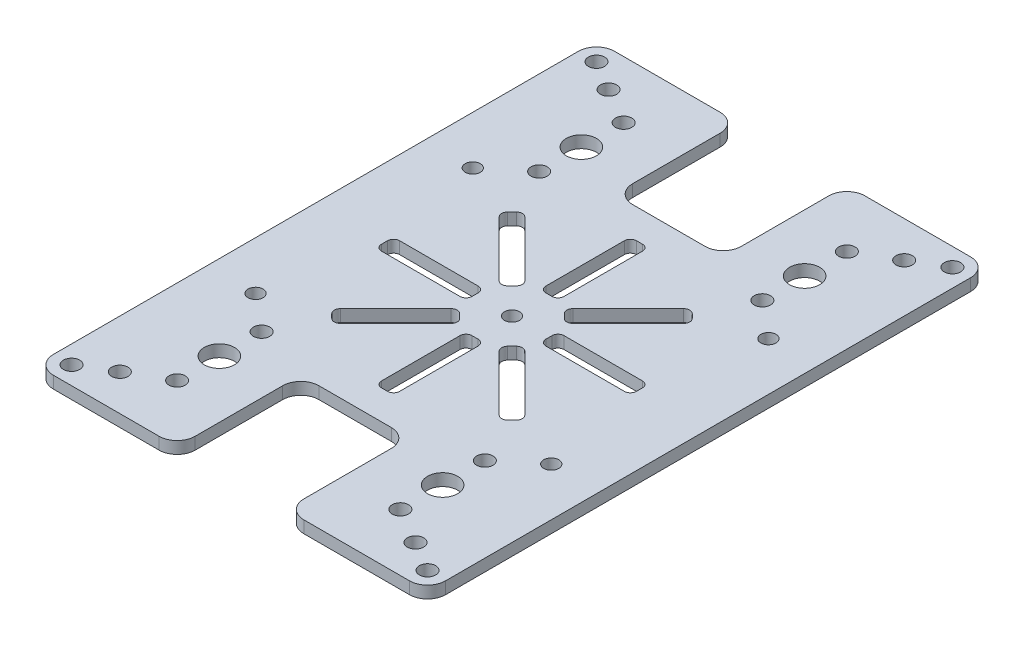
from build123d import *

# Parameters (mm, degrees)
BOSS_EXTRUDE1_DEPTH                          = 2
FILLET1_R                                    = 3
CUT_EXTRUDE1_REACH                           = 58.767
SKETCH2_R                                    = 1.25
CIRPATTERN1_COUNT                            = 8
CUT_EXTRUDE2_REACH                           = 58.767
SKETCH3_R                                    = 1.35
SKETCH3_R_2                                  = 1.25
SKETCH3_R_3                                  = 2.5
MIRROR1_AT_THE_SECOND_PLANE_COPY_1_REACH     = 58.767
MIRROR1_AT_THE_SECOND_PLANE_COPY_1_SKETC_R   = 1.35
MIRROR1_AT_THE_SECOND_PLANE_COPY_1_SKETC_R_2 = 1.25
MIRROR1_AT_THE_SECOND_PLANE_COPY_1_SKETC_R_3 = 2.5


with BuildPart() as part:
    # Sketch1 → Boss-Extrude1 (new body)
    with BuildSketch(Plane(origin=(0, 0, 0), x_dir=(1, 0, 0), z_dir=(0, 1, 0))):
        Polygon((9, 26), (-9, 26), (-9, 46.5), (-32.5, 46.5), (-32.5, -46.5), (-9, -46.5), (-9, -26), (9, -26), (9, -46.5), (32.5, -46.5), (32.5, 46.5), (9, 46.5), align=None)
    extrude(amount=BOSS_EXTRUDE1_DEPTH)

    # Fillet1
    fillet1_edges = [part.edges().sort_by_distance(p)[0] for p in [
        (-9, 1, -26),
        (9, 1, -26),
        (9, 1, -46.5),
        (32.5, 1, -46.5),
        (32.5, 1, 46.5),
        (9, 1, 46.5),
        (9, 1, 26),
        (-9, 1, 26),
        (-9, 1, 46.5),
        (-32.5, 1, 46.5),
        (-32.5, 1, -46.5),
        (-9, 1, -46.5),
    ]]
    fillet(fillet1_edges, radius=FILLET1_R)

    # Sketch2 → Cut-Extrude1 (cut, up to next)
    with BuildSketch(Plane(origin=(0, 2, 0), x_dir=(1, 0, 0), z_dir=(0, 1, 0)), mode=Mode.PRIVATE) as cut_extrude1_sk1:
        with Locations(Location((0, 0, 0), (0, 0, 270))):
            Circle(SKETCH2_R)
    cut_extrude1_tool1 = extrude(cut_extrude1_sk1.sketch, amount=-CUT_EXTRUDE1_REACH, mode=Mode.PRIVATE) & part.part
    # Sketch2 → Cut-Extrude1 (cut, up to next)
    with BuildSketch(Plane(origin=(0, 2, 0), x_dir=(1, 0, 0), z_dir=(0, 1, 0)), mode=Mode.PRIVATE) as cut_extrude1_sk2:
        with BuildLine():
            Line((0.5, 21.125), (-0.5, 21.125))
            ThreePointArc((-0.5, 21.125), (-1.207106781, 20.832106781), (-1.5, 20.125))
            Line((-1.5, 20.125), (-1.5, 7.125))
            ThreePointArc((-1.5, 7.125), (-1.207106781, 6.417893219), (-0.5, 6.125))
            Line((-0.5, 6.125), (0.5, 6.125))
            ThreePointArc((0.5, 6.125), (1.207106781, 6.417893219), (1.5, 7.125))
            Line((1.5, 7.125), (1.5, 20.125))
            ThreePointArc((1.5, 20.125), (1.207106781, 20.832106781), (0.5, 21.125))
        make_face()
    cut_extrude1_tool2 = extrude(cut_extrude1_sk2.sketch, amount=-CUT_EXTRUDE1_REACH, mode=Mode.PRIVATE) & part.part
    cut_extrude1_1 = cut_extrude1_tool1.solids().sort_by_distance((0, 2, 0))[0]
    add(cut_extrude1_1, mode=Mode.SUBTRACT)
    cut_extrude1_2 = cut_extrude1_tool2.solids().sort_by_distance((0, 2, -13.625))[0]
    add(cut_extrude1_2, mode=Mode.SUBTRACT)
    cut_extrude1 = cut_extrude1_1 + cut_extrude1_2  # Cut-Extrude1 as one shape, for the pattern or mirror that repeats it

    # CirPattern1: Cut-Extrude1 ×8 about axis
    cirpattern1_axis = Axis((0, 0, 0), (0, 1, 0))
    for i in range(1, CIRPATTERN1_COUNT):
        add(cut_extrude1.rotate(cirpattern1_axis, i * 360 / CIRPATTERN1_COUNT), mode=Mode.SUBTRACT)

    # Sketch3 → Cut-Extrude2 (cut, up to next)
    with BuildSketch(Plane(origin=(0, 2, 0), x_dir=(1, 0, 0), z_dir=(0, 1, 0)), mode=Mode.PRIVATE) as cut_extrude2_sk1:
        with Locations(Location((-29.5, 43.5, 0), (0, 0, 270))):
            Circle(SKETCH3_R)
    cut_extrude2_tool1 = extrude(cut_extrude2_sk1.sketch, amount=-CUT_EXTRUDE2_REACH, mode=Mode.PRIVATE) & part.part
    # Sketch3 → Cut-Extrude2 (cut, up to next)
    with BuildSketch(Plane(origin=(0, 2, 0), x_dir=(1, 0, 0), z_dir=(0, 1, 0)), mode=Mode.PRIVATE) as cut_extrude2_sk2:
        with Locations(Location((-24.5, 40.5, 0), (0, 0, 270))):
            Circle(SKETCH3_R)
    cut_extrude2_tool2 = extrude(cut_extrude2_sk2.sketch, amount=-CUT_EXTRUDE2_REACH, mode=Mode.PRIVATE) & part.part
    # Sketch3 → Cut-Extrude2 (cut, up to next)
    with BuildSketch(Plane(origin=(0, 2, 0), x_dir=(1, 0, 0), z_dir=(0, 1, 0)), mode=Mode.PRIVATE) as cut_extrude2_sk3:
        with Locations(Location((-24.5, 18, 0), (0, 0, 270))):
            Circle(SKETCH3_R_2)
    cut_extrude2_tool3 = extrude(cut_extrude2_sk3.sketch, amount=-CUT_EXTRUDE2_REACH, mode=Mode.PRIVATE) & part.part
    # Sketch3 → Cut-Extrude2 (cut, up to next)
    with BuildSketch(Plane(origin=(0, 2, 0), x_dir=(1, 0, 0), z_dir=(0, 1, 0)), mode=Mode.PRIVATE) as cut_extrude2_sk4:
        with Locations(Location((-18.5, 37, 0), (0, 0, 270))):
            Circle(SKETCH3_R)
    cut_extrude2_tool4 = extrude(cut_extrude2_sk4.sketch, amount=-CUT_EXTRUDE2_REACH, mode=Mode.PRIVATE) & part.part
    # Sketch3 → Cut-Extrude2 (cut, up to next)
    with BuildSketch(Plane(origin=(0, 2, 0), x_dir=(1, 0, 0), z_dir=(0, 1, 0)), mode=Mode.PRIVATE) as cut_extrude2_sk5:
        with Locations(Location((-18.5, 23, 0), (0, 0, 270))):
            Circle(SKETCH3_R)
    cut_extrude2_tool5 = extrude(cut_extrude2_sk5.sketch, amount=-CUT_EXTRUDE2_REACH, mode=Mode.PRIVATE) & part.part
    # Sketch3 → Cut-Extrude2 (cut, up to next)
    with BuildSketch(Plane(origin=(0, 2, 0), x_dir=(1, 0, 0), z_dir=(0, 1, 0)), mode=Mode.PRIVATE) as cut_extrude2_sk6:
        with Locations(Location((-18.5, 30, 0), (0, 0, 270))):
            Circle(SKETCH3_R_3)
    cut_extrude2_tool6 = extrude(cut_extrude2_sk6.sketch, amount=-CUT_EXTRUDE2_REACH, mode=Mode.PRIVATE) & part.part
    cut_extrude2_1 = cut_extrude2_tool1.solids().sort_by_distance((-29.5, 2, -43.5))[0]
    add(cut_extrude2_1, mode=Mode.SUBTRACT)
    cut_extrude2_2 = cut_extrude2_tool2.solids().sort_by_distance((-24.5, 2, -40.5))[0]
    add(cut_extrude2_2, mode=Mode.SUBTRACT)
    cut_extrude2_3 = cut_extrude2_tool3.solids().sort_by_distance((-24.5, 2, -18))[0]
    add(cut_extrude2_3, mode=Mode.SUBTRACT)
    cut_extrude2_4 = cut_extrude2_tool4.solids().sort_by_distance((-18.5, 2, -37))[0]
    add(cut_extrude2_4, mode=Mode.SUBTRACT)
    cut_extrude2_5 = cut_extrude2_tool5.solids().sort_by_distance((-18.5, 2, -23))[0]
    add(cut_extrude2_5, mode=Mode.SUBTRACT)
    cut_extrude2_6 = cut_extrude2_tool6.solids().sort_by_distance((-18.5, 2, -30))[0]
    add(cut_extrude2_6, mode=Mode.SUBTRACT)
    cut_extrude2 = cut_extrude2_1 + cut_extrude2_2 + cut_extrude2_3 + cut_extrude2_4 + cut_extrude2_5 + cut_extrude2_6  # Cut-Extrude2 as one shape, for the pattern or mirror that repeats it

    # Mirror1: Cut-Extrude2 across plane
    add(cut_extrude2.mirror(Plane(origin=(0, 0, 0), x_dir=(0, 0, 1), z_dir=(1, 0, 0))), mode=Mode.SUBTRACT)

    # Mirror1 at the second plane: Cut-Extrude2 across plane
    add(cut_extrude2.mirror(Plane.XY), mode=Mode.SUBTRACT)

    # Mirror1 at the second plane copy 1 sketc → Mirror1 at the second plane copy 1 (cut, up to next)
    with BuildSketch(Plane(origin=(0, 2, 0), x_dir=(-1, 0, 0), z_dir=(0, 1, 0)), mode=Mode.PRIVATE) as mirror1_at_the_second_plane_copy_1_sk1:
        with Locations(Location((-29.5, 43.5, 0), (0, 0, 270))):
            Circle(MIRROR1_AT_THE_SECOND_PLANE_COPY_1_SKETC_R)
    mirror1_at_the_second_plane_copy_1_tool1 = extrude(mirror1_at_the_second_plane_copy_1_sk1.sketch, amount=-MIRROR1_AT_THE_SECOND_PLANE_COPY_1_REACH, mode=Mode.PRIVATE) & part.part
    # Mirror1 at the second plane copy 1 sketc → Mirror1 at the second plane copy 1 (cut, up to next)
    with BuildSketch(Plane(origin=(0, 2, 0), x_dir=(-1, 0, 0), z_dir=(0, 1, 0)), mode=Mode.PRIVATE) as mirror1_at_the_second_plane_copy_1_sk2:
        with Locations(Location((-24.5, 40.5, 0), (0, 0, 270))):
            Circle(MIRROR1_AT_THE_SECOND_PLANE_COPY_1_SKETC_R)
    mirror1_at_the_second_plane_copy_1_tool2 = extrude(mirror1_at_the_second_plane_copy_1_sk2.sketch, amount=-MIRROR1_AT_THE_SECOND_PLANE_COPY_1_REACH, mode=Mode.PRIVATE) & part.part
    # Mirror1 at the second plane copy 1 sketc → Mirror1 at the second plane copy 1 (cut, up to next)
    with BuildSketch(Plane(origin=(0, 2, 0), x_dir=(-1, 0, 0), z_dir=(0, 1, 0)), mode=Mode.PRIVATE) as mirror1_at_the_second_plane_copy_1_sk3:
        with Locations(Location((-24.5, 18, 0), (0, 0, 270))):
            Circle(MIRROR1_AT_THE_SECOND_PLANE_COPY_1_SKETC_R_2)
    mirror1_at_the_second_plane_copy_1_tool3 = extrude(mirror1_at_the_second_plane_copy_1_sk3.sketch, amount=-MIRROR1_AT_THE_SECOND_PLANE_COPY_1_REACH, mode=Mode.PRIVATE) & part.part
    # Mirror1 at the second plane copy 1 sketc → Mirror1 at the second plane copy 1 (cut, up to next)
    with BuildSketch(Plane(origin=(0, 2, 0), x_dir=(-1, 0, 0), z_dir=(0, 1, 0)), mode=Mode.PRIVATE) as mirror1_at_the_second_plane_copy_1_sk4:
        with Locations(Location((-18.5, 37, 0), (0, 0, 270))):
            Circle(MIRROR1_AT_THE_SECOND_PLANE_COPY_1_SKETC_R)
    mirror1_at_the_second_plane_copy_1_tool4 = extrude(mirror1_at_the_second_plane_copy_1_sk4.sketch, amount=-MIRROR1_AT_THE_SECOND_PLANE_COPY_1_REACH, mode=Mode.PRIVATE) & part.part
    # Mirror1 at the second plane copy 1 sketc → Mirror1 at the second plane copy 1 (cut, up to next)
    with BuildSketch(Plane(origin=(0, 2, 0), x_dir=(-1, 0, 0), z_dir=(0, 1, 0)), mode=Mode.PRIVATE) as mirror1_at_the_second_plane_copy_1_sk5:
        with Locations(Location((-18.5, 23, 0), (0, 0, 270))):
            Circle(MIRROR1_AT_THE_SECOND_PLANE_COPY_1_SKETC_R)
    mirror1_at_the_second_plane_copy_1_tool5 = extrude(mirror1_at_the_second_plane_copy_1_sk5.sketch, amount=-MIRROR1_AT_THE_SECOND_PLANE_COPY_1_REACH, mode=Mode.PRIVATE) & part.part
    # Mirror1 at the second plane copy 1 sketc → Mirror1 at the second plane copy 1 (cut, up to next)
    with BuildSketch(Plane(origin=(0, 2, 0), x_dir=(-1, 0, 0), z_dir=(0, 1, 0)), mode=Mode.PRIVATE) as mirror1_at_the_second_plane_copy_1_sk6:
        with Locations(Location((-18.5, 30, 0), (0, 0, 270))):
            Circle(MIRROR1_AT_THE_SECOND_PLANE_COPY_1_SKETC_R_3)
    mirror1_at_the_second_plane_copy_1_tool6 = extrude(mirror1_at_the_second_plane_copy_1_sk6.sketch, amount=-MIRROR1_AT_THE_SECOND_PLANE_COPY_1_REACH, mode=Mode.PRIVATE) & part.part
    add(mirror1_at_the_second_plane_copy_1_tool1.solids().sort_by_distance((29.5, 2, 43.5))[0], mode=Mode.SUBTRACT)
    add(mirror1_at_the_second_plane_copy_1_tool2.solids().sort_by_distance((24.5, 2, 40.5))[0], mode=Mode.SUBTRACT)
    add(mirror1_at_the_second_plane_copy_1_tool3.solids().sort_by_distance((24.5, 2, 18))[0], mode=Mode.SUBTRACT)
    add(mirror1_at_the_second_plane_copy_1_tool4.solids().sort_by_distance((18.5, 2, 37))[0], mode=Mode.SUBTRACT)
    add(mirror1_at_the_second_plane_copy_1_tool5.solids().sort_by_distance((18.5, 2, 23))[0], mode=Mode.SUBTRACT)
    add(mirror1_at_the_second_plane_copy_1_tool6.solids().sort_by_distance((18.5, 2, 30))[0], mode=Mode.SUBTRACT)


solid = part.part
